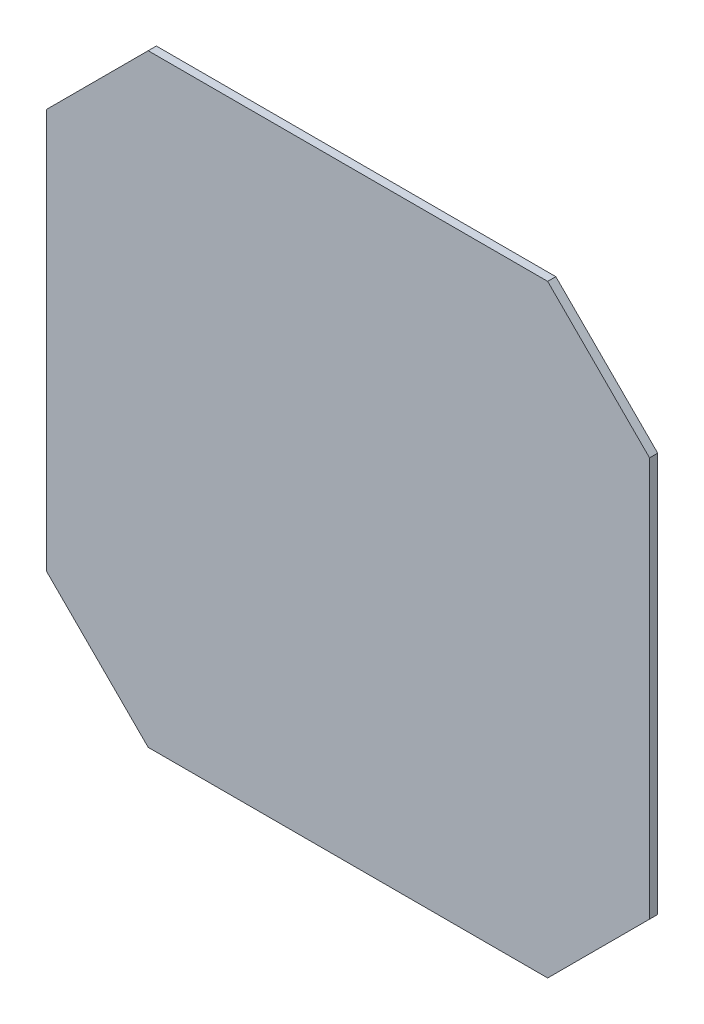
from build123d import *

# Parameters (mm, degrees)
BOSS_EXTRUDE1_DEPTH = 2


with BuildPart() as part:
    # Sketch1 → Boss-Extrude1 (new body)
    with BuildSketch(Plane.XY):
        Polygon((-74, 49), (-49, 74), (49, 74), (74, 49), (74, -49), (49, -74), (-49, -74), (-74, -49), align=None)
    extrude(amount=BOSS_EXTRUDE1_DEPTH)


solid = part.part
